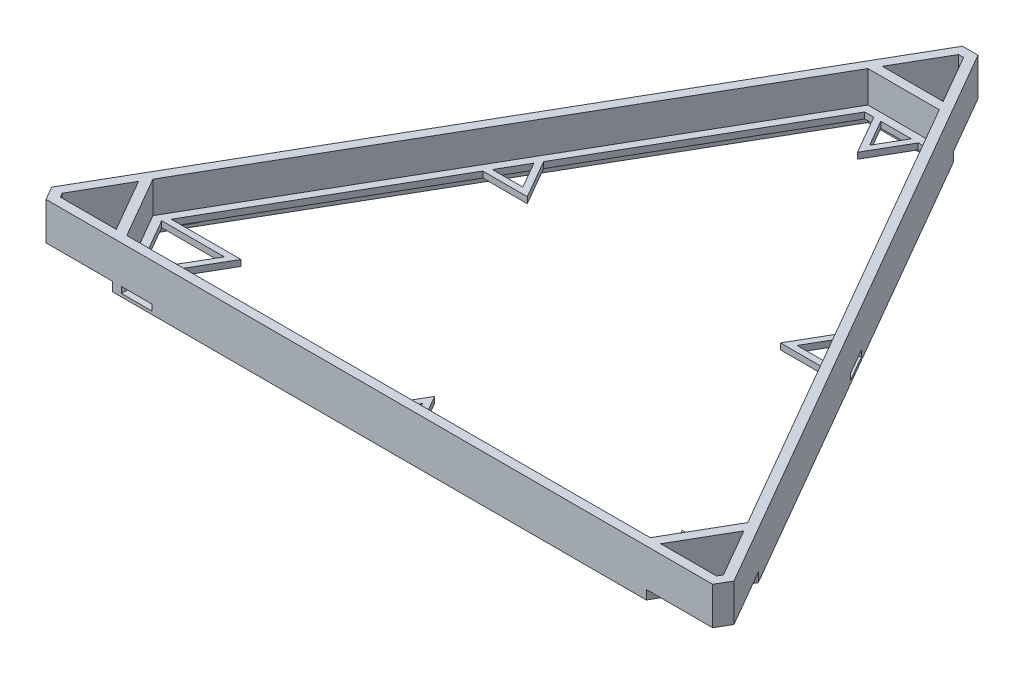
from build123d import *

# Parameters (mm, degrees)
BOSS_EXTRUDE1_DEPTH = 12.38
BOSS_EXTRUDE2_DEPTH = 2
BOSS_EXTRUDE3_DEPTH = 3
SKETCH4_W           = 10
SKETCH4_H           = 2
CUT_EXTRUDE1_DEPTH  = 6
SKETCH5_W           = 10
SKETCH5_H           = 2
CUT_EXTRUDE2_DEPTH  = 6
SKETCH6_W           = 10
SKETCH6_H           = 2
CUT_EXTRUDE3_DEPTH  = 6


with BuildPart() as part:
    # Sketch1 → Boss-Extrude1 (new body)
    with BuildSketch(Plane(origin=(0, 0, 0), x_dir=(1, 0, 0), z_dir=(0, 1, 0))):
        Polygon((109.556624327, -4.42820323), (-109.556624327, -4.42820323), (-112.113248654, 0), (-2.55662435, 189.757639654), (2.556624303, 189.757639654), (112.113248654, 0), align=None)
        Polygon((-107.82457352, -1.42820323), (-108.649147039, 0), (-99.473720558, 15.892304845), (-89.473720559, -1.42820323), align=None, mode=Mode.SUBTRACT)
        Polygon((-0.824573543, 186.757639627), (0.824573481, 186.757639627), (9.999999979, 170.86533478), (-10.000000021, 170.86533478), align=None, mode=Mode.SUBTRACT)
        Polygon((108.649147039, 0), (107.82457353, -1.428203222), (89.473720569, -1.428203222), (99.473720569, 15.892304853), align=None, mode=Mode.SUBTRACT)
        Polygon((-11.732050803, 167.865334802), (11.732050803, 167.865334802), (97.741669765, 18.89230486), (86.00961895, -1.428203229), (-86.009618944, -1.428203229), (-97.741669751, 18.892304845), align=None, mode=Mode.SUBTRACT)
    extrude(amount=BOSS_EXTRUDE1_DEPTH)

    # Sketch1<4> → Boss-Extrude2 (add)
    with BuildSketch(Plane(origin=(0, 0, 0), x_dir=(1, 0, 0), z_dir=(0, 1, 0))):
        Polygon((11.732050803, 167.865334802), (-11.732050803, 167.865334802), (-97.741669751, 18.892304845), (-86.009618944, -1.428203229), (86.00961895, -1.428203229), (97.741669765, 18.89230486), align=None)
        Polygon((-84.566243256, 1.071796796), (-94.854918378, 18.892304849), (-74.277568135, 18.892304849), align=None, mode=Mode.SUBTRACT)
        Polygon((-1e-08, 9.732050841), (4.99999999, 1.071796803), (-5.00000001, 1.071796803), align=None, mode=Mode.SUBTRACT)
        Polygon((-45.071796745, 87.798692801), (-55.071796745, 87.798692801), (-50.071796745, 96.458946839), align=None, mode=Mode.SUBTRACT)
        Polygon((82.210580848, 14.312177834), (92.210580848, 14.312177834), (87.210580848, 5.651923796), align=None, mode=Mode.SUBTRACT)
        Polygon((48.91709624, 98.458946834), (41.607695163, 85.798692796), (56.226497316, 85.798692796), (94.854918412, 18.892304841), (93.36528139, 16.312177834), (78.746479233, 16.312177834), (86.055880312, 3.651923793), (84.566243293, 1.071796793), (7.309401088, 1.071796793), (2e-09, 13.732050847), (-7.309401083, 1.071796796), (-82.256842179, 1.071796796), (-70.813466519, 20.892304849), (-93.70021784, 20.892304849), (-56.226497283, 85.798692801), (-41.60769513, 85.798692801), (-48.917096207, 98.458946839), (-10.288675112, 165.365334792), (-7.309401077, 165.365334792), (0, 152.705080754), (7.309401077, 165.365334792), (10.288675142, 165.365334792), align=None, mode=Mode.SUBTRACT)
        Polygon((45.071796778, 87.798692803), (50.071796778, 96.458946841), (55.071796778, 87.798692803), align=None, mode=Mode.SUBTRACT)
        Polygon((0, 156.705080761), (-5, 165.365334799), (5, 165.365334799), align=None, mode=Mode.SUBTRACT)
    extrude(amount=BOSS_EXTRUDE2_DEPTH)

    # Sketch2 → Boss-Extrude3 (add)
    with BuildSketch(Plane.XZ):
        Polygon((101.205771363, -18.892304847), (87.741669751, 4.42820323), (-87.741669751, 4.42820323), (-101.205771368, -18.892304847), (-13.464101652, -170.86533478), (13.464101609, -170.86533478), align=None)
        Polygon((-11.732050819, -167.865334802), (11.732050795, -167.865334802), (97.741669739, -18.892304852), (86.009618931, 1.42820323), (-86.009618931, 1.42820323), (-97.741669763, -18.892304852), align=None, mode=Mode.SUBTRACT)
    extrude(amount=BOSS_EXTRUDE3_DEPTH)

    # Sketch4 → Cut-Extrude1 (cut)
    with BuildSketch(Plane.XY.offset(4.42820323)):
        with Locations((-79.741669751, -1)):
            Rectangle(SKETCH4_W, SKETCH4_H)
    extrude(amount=-CUT_EXTRUDE1_DEPTH, mode=Mode.SUBTRACT)

    # Sketch5 → Cut-Extrude2 (cut)
    with BuildSketch(Plane(origin=(-84.084936503, 0, -48.546460711), x_dir=(-0.4999999998935114, 0, 0.86602540384592), z_dir=(-0.86602540384592, 0, -0.4999999998935114))):
        with Locations((26.241669739, -1)):
            Rectangle(SKETCH5_W, SKETCH5_H)
    extrude(amount=-CUT_EXTRUDE2_DEPTH, mode=Mode.SUBTRACT)

    # Sketch6 → Cut-Extrude3 (cut)
    with BuildSketch(Plane(origin=(84.084936484, 0, -48.546460721), x_dir=(-0.5000000000540236, 0, -0.8660254037532481), z_dir=(0.8660254037532481, 0, -0.5000000000540236))):
        with Locations((53.499999991, -1)):
            Rectangle(SKETCH6_W, SKETCH6_H)
    extrude(amount=-CUT_EXTRUDE3_DEPTH, mode=Mode.SUBTRACT)


solid = part.part
